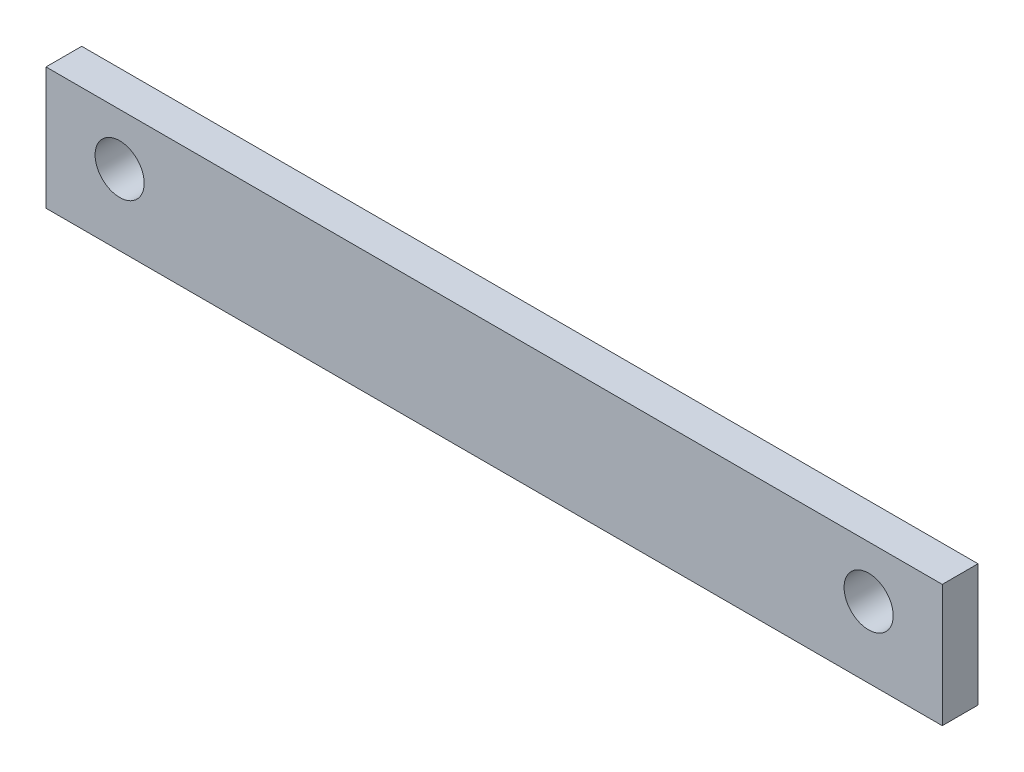
from build123d import *

# Parameters (mm, degrees)
SKETCH1_R           = 2.75
BOSS_EXTRUDE1_DEPTH = 4
CUT_EXTRUDE1_DEPTH  = 10
BOSS_EXTRUDE3_START = -4
SKETCH3_R           = 2.75
BOSS_EXTRUDE3_DEPTH = 4
BOSS_EXTRUDE4_START = -4
SKETCH4_R           = 2.75
BOSS_EXTRUDE4_DEPTH = 4


with BuildPart() as part:
    # Sketch1 → Boss-Extrude1 (new body)
    with BuildSketch(Plane.XY):
        with BuildLine():
            Line((24.072178339, 16.5927117), (-24.072178339, 16.5927117))
            ThreePointArc((-24.072178339, 16.5927117), (-24.779285121, 16.299818481), (-25.072178339, 15.5927117))
            Line((-25.072178339, 15.5927117), (-25.072178339, 8.49545414))
            ThreePointArc((-25.072178339, 8.49545414), (-24.955491664, 8.026671065), (-24.632663198, 7.667289468))
            Line((-24.632663198, 7.667289468), (-1.120969717, -8.244942286))
            ThreePointArc((-1.120969717, -8.244942286), (0, -8.588612943), (1.120969717, -8.244942286))
            Line((1.120969717, -8.244942286), (24.632663198, 7.667289468))
            ThreePointArc((24.632663198, 7.667289468), (24.955491664, 8.026671065), (25.072178339, 8.49545414))
            Line((25.072178339, 8.49545414), (25.072178339, 15.5927117))
            ThreePointArc((25.072178339, 15.5927117), (24.779285121, 16.299818481), (24.072178339, 16.5927117))
        make_face()
        Circle(SKETCH1_R, mode=Mode.SUBTRACT)
        with Locations((-16.827094957, 10.809665828)):
            Circle(SKETCH1_R, mode=Mode.SUBTRACT)
        with Locations((16.827094957, 10.809665828)):
            Circle(SKETCH1_R, mode=Mode.SUBTRACT)
    extrude(amount=BOSS_EXTRUDE1_DEPTH)

    # Sketch2 → Cut-Extrude1 (cut)
    with BuildSketch(Plane.XY.offset(4)):
        Polygon((-24.632663198, 7.667289468), (24.632663198, 7.667289468), (0.25604332, -10.053182783), align=None)
    extrude(amount=-CUT_EXTRUDE1_DEPTH, mode=Mode.SUBTRACT)

    # Sketch3 → Boss-Extrude3 (add)
    # profile 1 of 2: a face of its own
    with BuildSketch(Plane.XY.offset(4).offset(BOSS_EXTRUDE3_START)):
        with BuildLine():
            Line((-24.072178339, 16.5927117), (-25.072178339, 16.5927117))
            Line((-25.072178339, 16.5927117), (-25.072178339, 15.5927117))
            ThreePointArc((-25.072178339, 15.5927117), (-24.779285121, 16.299818481), (-24.072178339, 16.5927117))
        make_face()
    # profile 2 of 2: a face of its own
    with BuildSketch(Plane.XY.offset(4).offset(BOSS_EXTRUDE3_START)):
        with BuildLine():
            ThreePointArc((-24.632663198, 7.667289468), (-24.955491664, 8.026671065), (-25.072178339, 8.49545414))
            Line((-25.072178339, 8.49545414), (-25.072178339, 2.887491698))
            Line((-25.072178339, 2.887491698), (75.267657001, 2.887491698))
            Line((75.267657001, 2.887491698), (75.267657001, 16.5927117))
            Line((75.267657001, 16.5927117), (24.072178339, 16.5927117))
            ThreePointArc((24.072178339, 16.5927117), (24.779285121, 16.299818481), (25.072178339, 15.5927117))
            Line((25.072178339, 15.5927117), (25.072178339, 8.49545414))
            ThreePointArc((25.072178339, 8.49545414), (24.955491664, 8.026671065), (24.632663198, 7.667289468))
            Line((24.632663198, 7.667289468), (-24.632663198, 7.667289468))
        make_face()
        with Locations((67.022573618, 10.809665828)):
            Circle(SKETCH3_R, mode=Mode.SUBTRACT)
    extrude(amount=BOSS_EXTRUDE3_DEPTH)

    # Sketch4 → Boss-Extrude4 (add)
    with BuildSketch(Plane.XY.offset(4).offset(BOSS_EXTRUDE4_START)):
        with Locations((16.827094957, 10.809665828)):
            Circle(SKETCH4_R)
    extrude(amount=BOSS_EXTRUDE4_DEPTH)


solid = part.part
